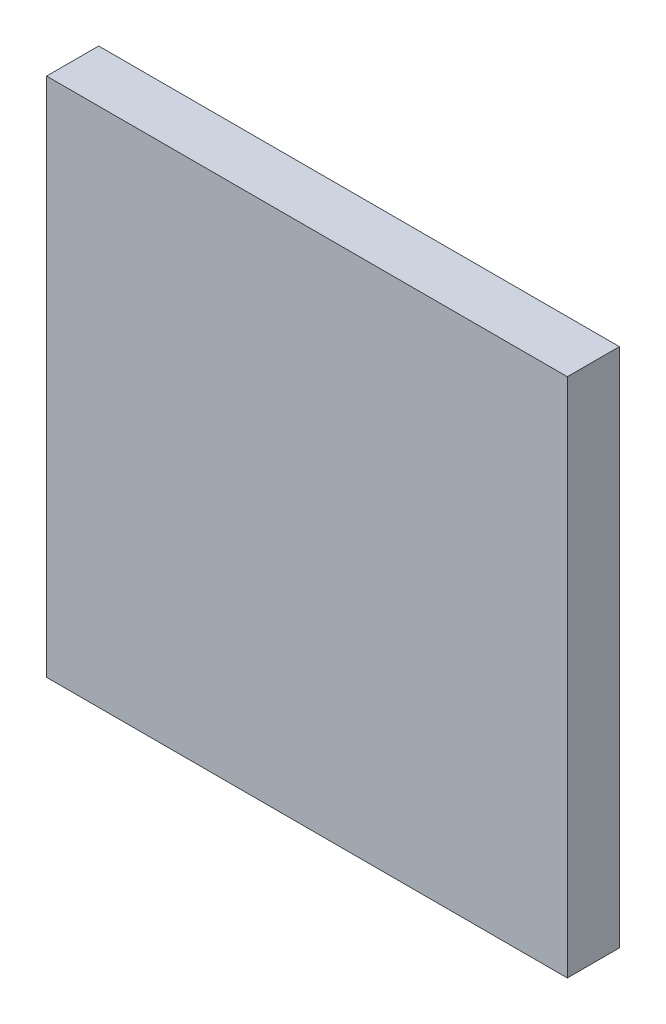
from build123d import *

# Parameters (mm, degrees)
SKETCH_1_W      = 100
SKETCH_1_H      = 100
EXTRUDE_1_DEPTH = 10


with BuildPart() as part:
    # ｽｹｯﾁ1 → ﾎﾞｽ - 押し出し1 (new body)
    with BuildSketch(Plane.XY):
        with Locations((-0.223234002, 41.119221411)):
            Rectangle(SKETCH_1_W, SKETCH_1_H)
    extrude(amount=EXTRUDE_1_DEPTH)


solid = part.part
